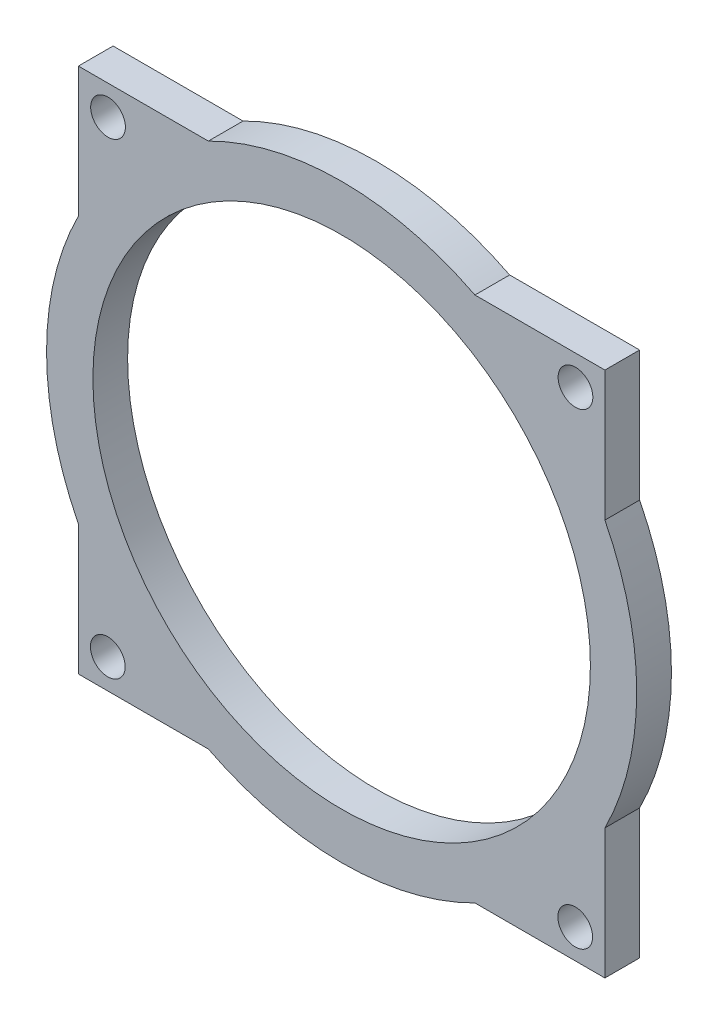
from build123d import *

# Parameters (mm, degrees)
SKETCH1_R           = 1.5
SKETCH1_R_2         = 21.49615086
BOSS_EXTRUDE1_DEPTH = 3


with BuildPart() as part:
    # Sketch1 → Boss-Extrude1 (new body)
    # profile 1 of 2: a face of its own
    with BuildSketch(Plane.XY):
        with BuildLine():
            Line((22.75, -22.75), (22.75, -11.519006034))
            ThreePointArc((22.75, -11.519006034), (25.5, 0), (22.75, 11.519006034))
            Line((22.75, 11.519006034), (22.75, 22.75))
            Line((22.75, 22.75), (11.519006034, 22.75))
            ThreePointArc((11.519006034, 22.75), (0, 25.5), (-11.519006034, 22.75))
            Line((-11.519006034, 22.75), (-22.75, 22.75))
            Line((-22.75, 22.75), (-22.75, 11.519006034))
            ThreePointArc((-22.75, 11.519006034), (-18.03122292, -18.03122292), (11.519006034, -22.75))
            Line((11.519006034, -22.75), (22.75, -22.75))
        make_face()
        with Locations((20.207389371, 20.188817575)):
            Circle(SKETCH1_R, mode=Mode.SUBTRACT)
        with Locations((-20.188817575, 20.207389371)):
            Circle(SKETCH1_R, mode=Mode.SUBTRACT)
        with Locations((20.188817575, -20.207389371)):
            Circle(SKETCH1_R, mode=Mode.SUBTRACT)
        Circle(SKETCH1_R_2, mode=Mode.SUBTRACT)
    # profile 2 of 2: a face of its own
    with BuildSketch(Plane.XY):
        with BuildLine():
            Line((-22.75, -22.75), (-11.519006034, -22.75))
            ThreePointArc((-11.519006034, -22.75), (-18.03122292, -18.03122292), (-22.75, -11.519006034))
            Line((-22.75, -11.519006034), (-22.75, -22.75))
        make_face()
        with Locations((-20.207389371, -20.188817575)):
            Circle(SKETCH1_R, mode=Mode.SUBTRACT)
    extrude(amount=BOSS_EXTRUDE1_DEPTH)


solid = part.part
